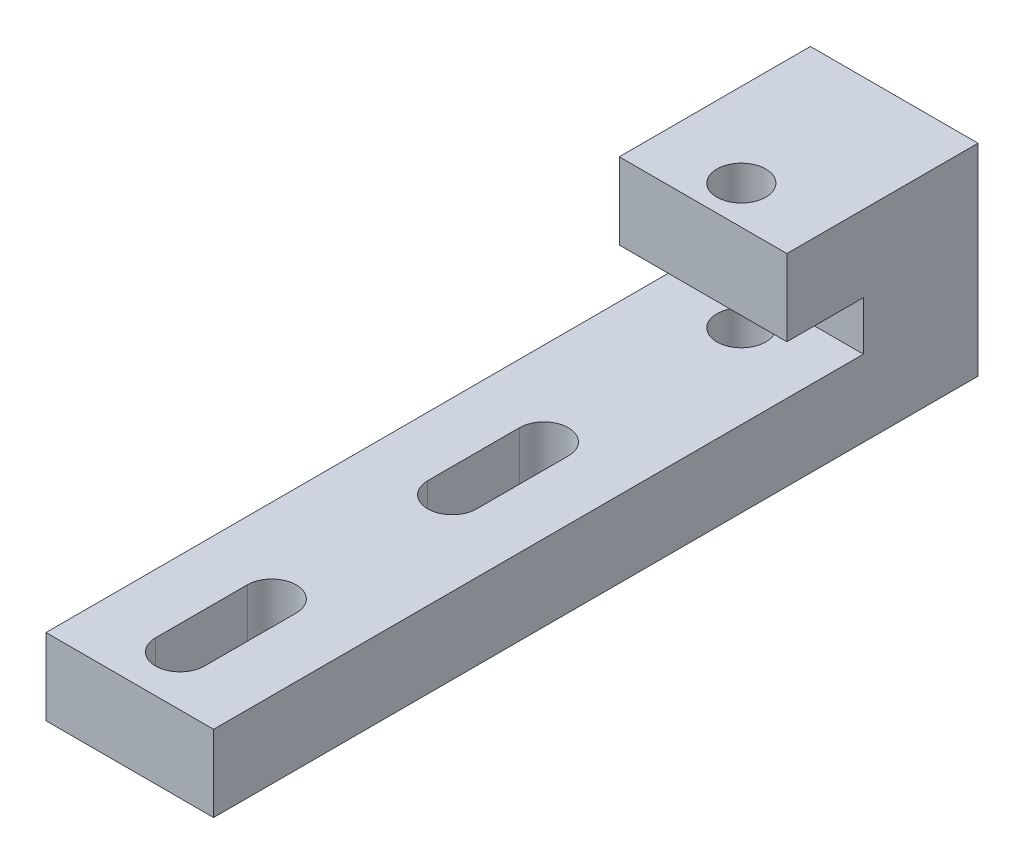
from build123d import *

# Parameters (mm, degrees)
SKETCH1_W               = 10.962182916
SKETCH1_H               = 45
SKETCH1_R               = 1.25
BOSS_EXTRUDE1_DEPTH     = 5
SKETCH2_W               = 10.962182916
SKETCH2_H               = 2.5
BOSS_EXTRUDE2_DEPTH     = 8.2
SKETCH3_W               = 10.962182916
SKETCH3_H               = 5
BOSS_EXTRUDE3_DEPTH     = 5
CUT_EXTRUDE1_DEPTH      = 48.036256806
CUT_EXTRUDE1_DEPTH_BACK = 48.036256806
SKETCH4_R               = 1.6
SKETCH5_W               = 10.962182916
SKETCH5_H               = 13.2
BOSS_EXTRUDE4_DEPTH     = 5


with BuildPart() as part:
    # Sketch1 → Boss-Extrude1 (new body)
    with BuildSketch(Plane(origin=(0, 0, 0), x_dir=(1, 0, 0), z_dir=(0, 1, 0))):
        with Locations((5.481091458, 22.5)):
            Rectangle(SKETCH1_W, SKETCH1_H)
        with Locations(Location((5.481091458, 40, 0), (0, 0, 270))):
            Circle(SKETCH1_R, mode=Mode.SUBTRACT)
        with BuildLine():
            Line((7.081091458, 27.08548866), (7.081091458, 21.08548866))
            ThreePointArc((7.081091458, 21.08548866), (5.481091458, 19.48548866), (3.881091458, 21.08548866))
            Line((3.881091458, 21.08548866), (3.881091458, 27.08548866))
            ThreePointArc((3.881091458, 27.08548866), (5.481091458, 28.68548866), (7.081091458, 27.08548866))
        make_face(mode=Mode.SUBTRACT)
        with BuildLine():
            Line((3.881091458, 3.28548866), (3.881091458, 9.28548866))
            ThreePointArc((3.881091458, 9.28548866), (5.481091458, 10.88548866), (7.081091458, 9.28548866))
            Line((7.081091458, 9.28548866), (7.081091458, 3.28548866))
            ThreePointArc((7.081091458, 3.28548866), (5.481091458, 1.68548866), (3.881091458, 3.28548866))
        make_face(mode=Mode.SUBTRACT)
    extrude(amount=BOSS_EXTRUDE1_DEPTH)

    # Sketch2 → Boss-Extrude2 (add)
    with BuildSketch(Plane(origin=(0, 5, 0), x_dir=(1, 0, 0), z_dir=(0, 1, 0))):
        with Locations((5.481091458, 43.75)):
            Rectangle(SKETCH2_W, SKETCH2_H)
    extrude(amount=BOSS_EXTRUDE2_DEPTH)

    # Sketch3 → Boss-Extrude3 (add)
    with BuildSketch(Plane.XY.offset(-42.5)):
        with Locations((5.481091458, 10.7)):
            Rectangle(SKETCH3_W, SKETCH3_H)
    extrude(amount=BOSS_EXTRUDE3_DEPTH)

    # Sketch4 → Cut-Extrude1 (cut, two sides: drawn at the far end of the back side and taken through both)
    with BuildSketch(Plane.XZ.offset(-8.2).offset(-CUT_EXTRUDE1_DEPTH_BACK)):
        with Locations(Location((5.481091458, -40, 0), (0, 0, 270))):
            Circle(SKETCH4_R)
    extrude(amount=CUT_EXTRUDE1_DEPTH + CUT_EXTRUDE1_DEPTH_BACK, mode=Mode.SUBTRACT)

    # Sketch5 → Boss-Extrude4 (add)
    with BuildSketch(Plane(origin=(0, 0, -45), x_dir=(-1, 0, 0), z_dir=(0, 0, -1))):
        with Locations((-5.481091458, 6.6)):
            Rectangle(SKETCH5_W, SKETCH5_H)
    extrude(amount=BOSS_EXTRUDE4_DEPTH)


solid = part.part
